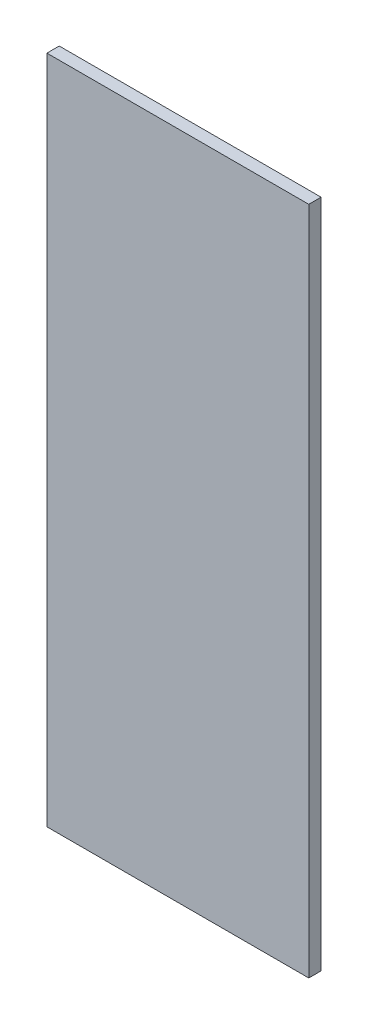
from build123d import *

# Parameters (mm, degrees)
SKETCH1_W           = 34
SKETCH1_H           = 87
BOSS_EXTRUDE1_DEPTH = 1.6


with BuildPart() as part:
    # Sketch1 → Boss-Extrude1 (new body)
    with BuildSketch(Plane.XY):
        with Locations((17, -43.5)):
            Rectangle(SKETCH1_W, SKETCH1_H)
    extrude(amount=BOSS_EXTRUDE1_DEPTH)


solid = part.part
